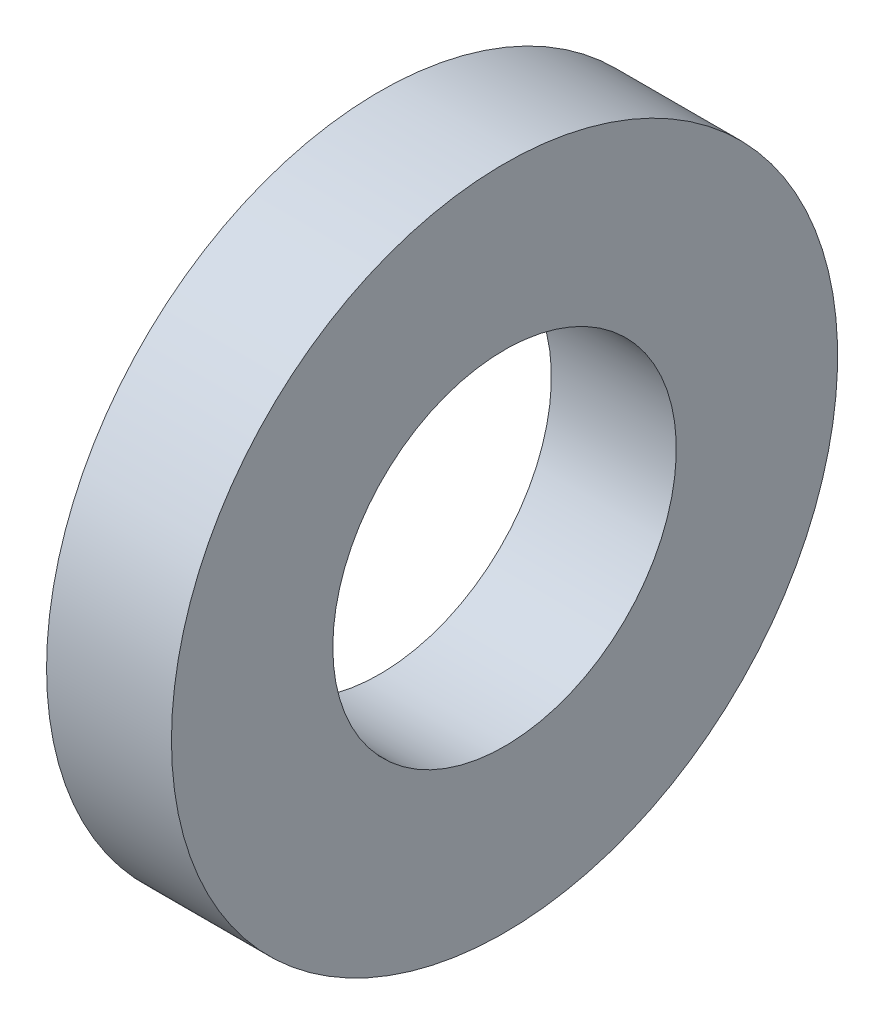
from build123d import *

# Parameters (mm, degrees)
AXIAL_PROFILE_MM_W = 1.2
AXIAL_PROFILE_MM_H = 1.55


with BuildPart() as part:
    # Axial profile (mm) → Full revolution (revolve)
    with BuildSketch(Plane.XY, mode=Mode.PRIVATE) as full_revolution_sk:
        with Locations((135.1, 2.425)):
            Rectangle(AXIAL_PROFILE_MM_W, AXIAL_PROFILE_MM_H)
    revolve(full_revolution_sk.sketch.rotate(Axis((-110, 0, 0), (1, 0, 0)), 90), axis=Axis((-110, 0, 0), (1, 0, 0)))


solid = part.part
